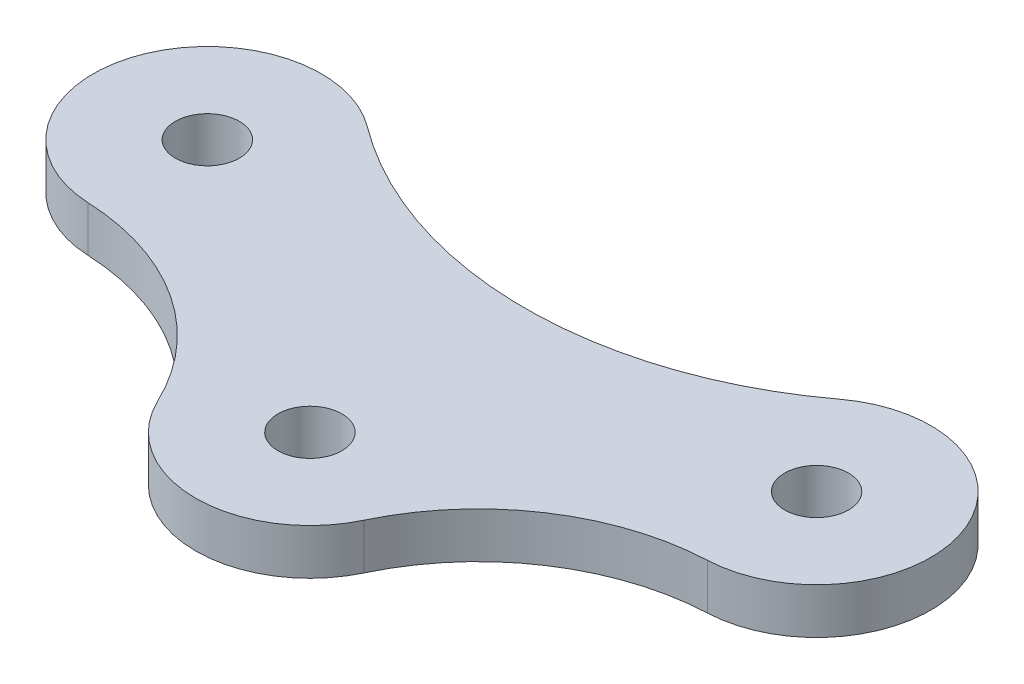
from build123d import *

# Parameters (mm, degrees)
SKETCH1_R           = 2.1
BOSS_EXTRUDE1_DEPTH = 3


with BuildPart() as part:
    # Sketch1 → Boss-Extrude1 (new body)
    with BuildSketch(Plane(origin=(0, 0, 0), x_dir=(1, 0, 0), z_dir=(0, 1, 0))):
        with BuildLine():
            ThreePointArc((-6.773431823, -3.22034491), (0, -7.5), (6.773431823, -3.22034491))
            ThreePointArc((6.773431823, -3.22034491), (12.3053133, 3.157859017), (20.332742003, 5.773883946))
            ThreePointArc((20.332742003, 5.773883946), (27.062266479, 15.791255027), (15.507209772, 19.271899728))
            ThreePointArc((15.507209772, 19.271899728), (0, 14.113175247), (-15.507209772, 19.271899728))
            ThreePointArc((-15.507209772, 19.271899728), (-27.062266479, 15.791255027), (-20.332742003, 5.773883946))
            ThreePointArc((-20.332742003, 5.773883946), (-12.3053133, 3.157859017), (-6.773431823, -3.22034491))
        make_face()
        with Locations(Location((0, 0, 0), (0, 0, 270))):
            Circle(SKETCH1_R, mode=Mode.SUBTRACT)
        with Locations(Location((20, 13.266499161, 0), (0, 0, 270))):
            Circle(SKETCH1_R, mode=Mode.SUBTRACT)
        with Locations(Location((-20, 13.266499161, 0), (0, 0, 270))):
            Circle(SKETCH1_R, mode=Mode.SUBTRACT)
    extrude(amount=BOSS_EXTRUDE1_DEPTH)


solid = part.part
